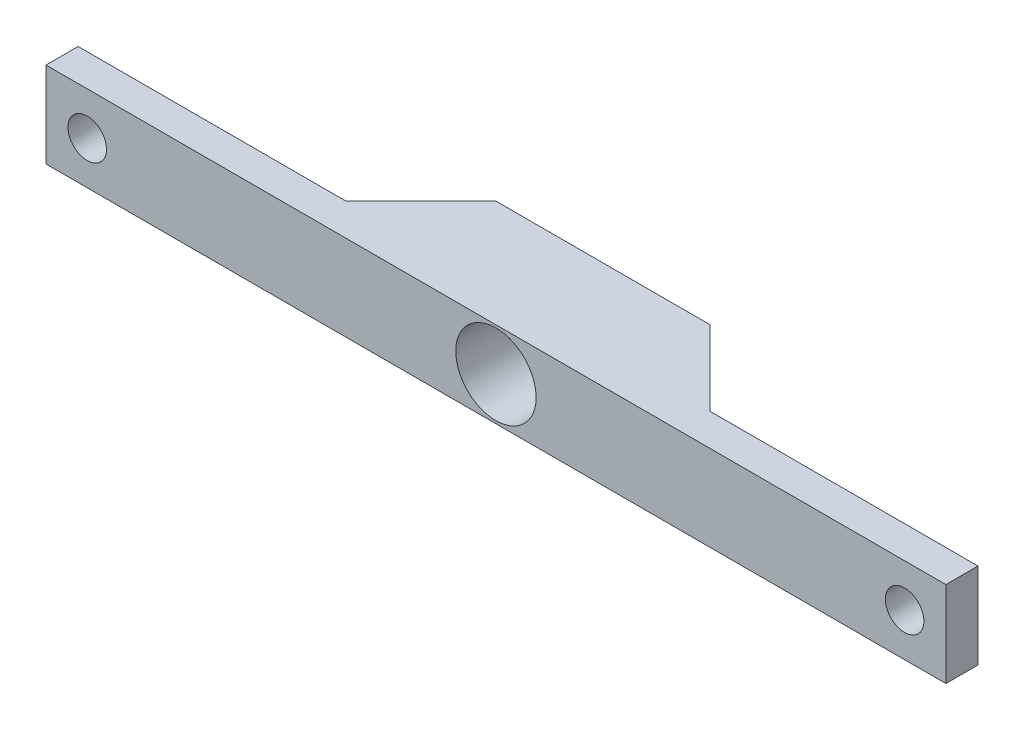
from build123d import *

# Parameters (mm, degrees)
BOSS_EXTRUDE1_DEPTH = 8
SKETCH3_W           = 84
SKETCH3_H           = 8
BOSS_EXTRUDE3_DEPTH = 3
SKETCH4_R           = 1.8
CUT_EXTRUDE1_DEPTH  = 44.9089968
SKETCH5_R           = 1.8
CUT_EXTRUDE2_DEPTH  = 44.9089968
SKETCH6_R           = 3.75
CUT_EXTRUDE3_DEPTH  = 6


with BuildPart() as part:
    # Sketch2 → Boss-Extrude1 (new body)
    with BuildSketch(Plane(origin=(0, 0, 0), x_dir=(1, 0, 0), z_dir=(0, 1, 0))):
        Polygon((-10, 0), (10, 0), (20, -10), (-20, -10), align=None)
    extrude(amount=BOSS_EXTRUDE1_DEPTH)

    # Sketch3 → Boss-Extrude3 (add)
    with BuildSketch(Plane.XY.offset(10)):
        with Locations((0, 4)):
            Rectangle(SKETCH3_W, SKETCH3_H)
    extrude(amount=-BOSS_EXTRUDE3_DEPTH)

    # Sketch4 → Cut-Extrude1 (cut, through all)
    with BuildSketch(Plane.XY.offset(10)):
        with Locations((-38.15, 4)):
            Circle(SKETCH4_R)
        with Locations((38.15, 4)):
            Circle(SKETCH4_R)
    extrude(amount=-CUT_EXTRUDE1_DEPTH, mode=Mode.SUBTRACT)

    # Sketch5 → Cut-Extrude2 (cut, through all)
    with BuildSketch(Plane(origin=(0, 0, 0), x_dir=(-1, 0, 0), z_dir=(0, 0, -1))):
        with Locations((0, 4)):
            Circle(SKETCH5_R)
    extrude(amount=-CUT_EXTRUDE2_DEPTH, mode=Mode.SUBTRACT)

    # Sketch6 → Cut-Extrude3 (cut)
    with BuildSketch(Plane.XY.offset(10)):
        with Locations((0, 4)):
            Circle(SKETCH6_R)
    extrude(amount=-CUT_EXTRUDE3_DEPTH, mode=Mode.SUBTRACT)


solid = part.part
